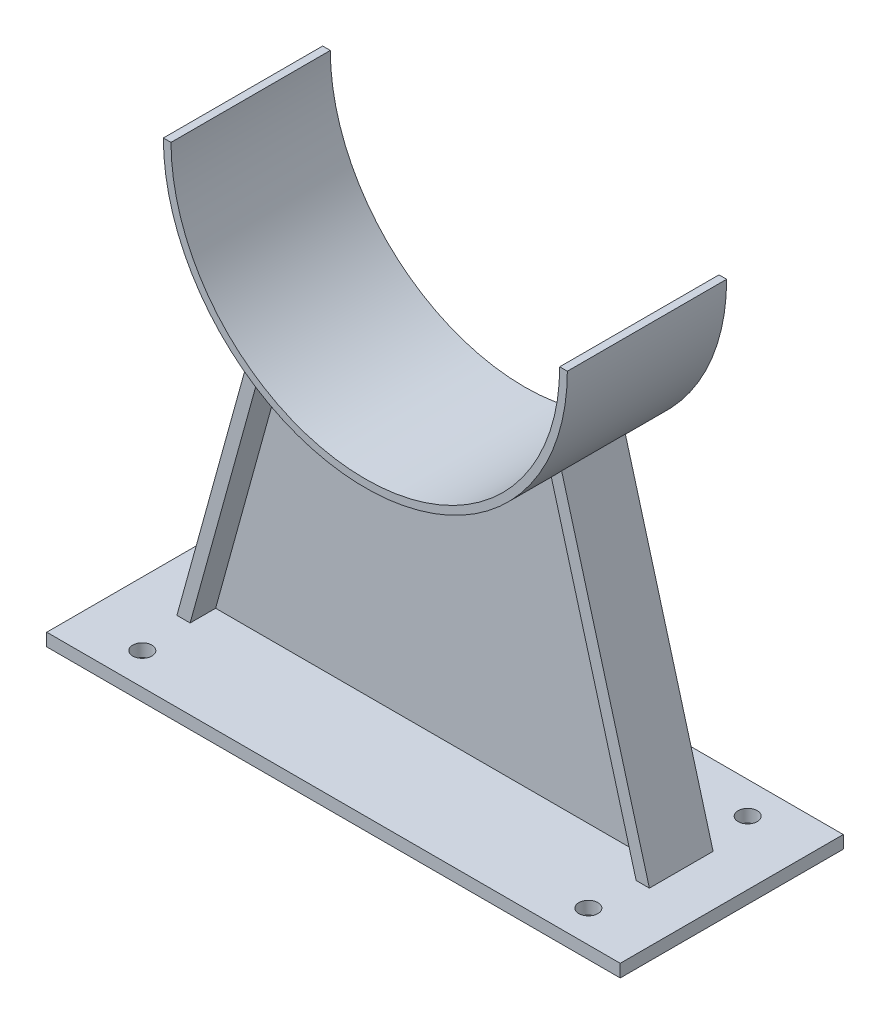
from build123d import *

# Parameters (mm, degrees)
BOSS_EXTRUDE1_DEPTH = 125
BOSS_EXTRUDE2_DEPTH = 10
SKETCH3_W           = 900
SKETCH3_H           = 350
SKETCH3_R           = 15
BOSS_EXTRUDE3_DEPTH = 20
SKETCH5_W           = 100
SKETCH5_H           = 540
BOSS_EXTRUDE4_DEPTH = 20
CUT_EXTRUDE1_START  = -676
CUT_EXTRUDE1_DEPTH  = 676


with BuildPart() as part:
    # Sketch1 → Boss-Extrude1 (new, symmetric)
    with BuildSketch(Plane.XY):
        with BuildLine():
            Line((-317, 0), (-305, 0))
            ThreePointArc((-305, 0), (0, -305), (305, 0))
            Line((305, 0), (317, 0))
            ThreePointArc((317, 0), (0, -317), (-317, 0))
        make_face()
    extrude(amount=BOSS_EXTRUDE1_DEPTH, both=True)

    # Sketch2 → Boss-Extrude2 (add, symmetric)
    with BuildSketch(Plane.XY):
        with BuildLine():
            Line((-216.821053663, -231.252309585), (-350, -713.189409477))
            Line((-350, -713.189409477), (350, -713.189409477))
            Line((350, -713.189409477), (216.821053663, -231.252309585))
            ThreePointArc((216.821053663, -231.252309585), (0, -317), (-216.821053663, -231.252309585))
        make_face()
    extrude(amount=BOSS_EXTRUDE2_DEPTH, both=True)

    # Sketch3 → Boss-Extrude3 (add)
    with BuildSketch(Plane.XZ.offset(713.189409477)):
        Rectangle(SKETCH3_W, SKETCH3_H)
        with Locations(Location((-350, 125, 0), (0, 0, 270))):
            Circle(SKETCH3_R, mode=Mode.SUBTRACT)
        with Locations(Location((350, 125, 0), (0, 0, 270))):
            Circle(SKETCH3_R, mode=Mode.SUBTRACT)
        with Locations(Location((-350, -125, 0), (0, 0, 270))):
            Circle(SKETCH3_R, mode=Mode.SUBTRACT)
        with Locations(Location((350, -125, 0), (0, 0, 270))):
            Circle(SKETCH3_R, mode=Mode.SUBTRACT)
    extrude(amount=BOSS_EXTRUDE3_DEPTH)

    # Sketch5 → Boss-Extrude4 (add)
    with BuildSketch(Plane(origin=(-142.067675448, 39.259113542, 0), x_dir=(0, 0, 1), z_dir=(-0.9638741997846356, 0.266357892673614, 0))):
        with Locations((0, -530.650133791)):
            Rectangle(SKETCH5_W, SKETCH5_H)
    boss_extrude4 = extrude(amount=BOSS_EXTRUDE4_DEPTH)

    # Mirror1: Boss-Extrude4 across plane
    add(boss_extrude4.mirror(Plane(origin=(0, 0, 0), x_dir=(0, 0, 1), z_dir=(1, 0, 0))))

    # Sketch6 → Cut-Extrude1 (cut)
    with BuildSketch(Plane(origin=(0, 0, -125), x_dir=(-1, 0, 0), z_dir=(0, 0, -1)).offset(CUT_EXTRUDE1_START)):
        with BuildLine():
            Line((-305, 0), (305, 0))
            ThreePointArc((305, 0), (0, -305), (-305, 0))
        make_face()
    extrude(amount=CUT_EXTRUDE1_DEPTH, mode=Mode.SUBTRACT)


solid = part.part
